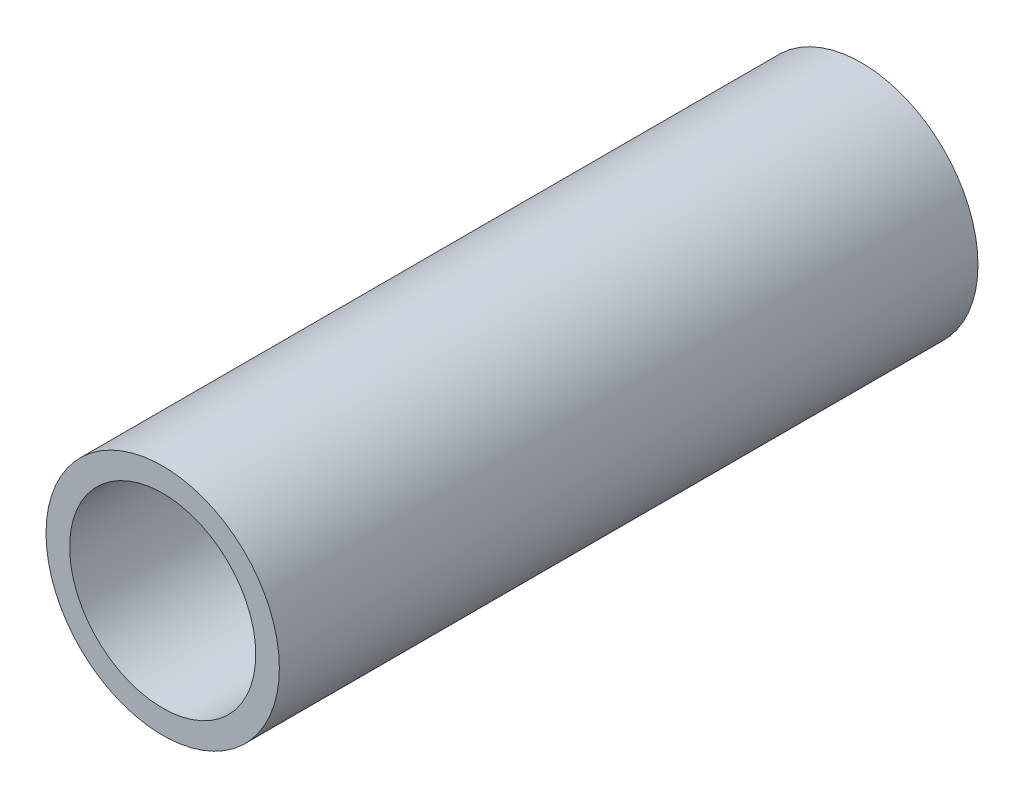
from build123d import *

# Parameters (mm, degrees)
SKETCH1_R           = 16.7005
SKETCH1_R_2         = 13.3223
EXTRUDE_THIN1_DEPTH = 50


with BuildPart() as part:
    # Sketch1 → Extrude-Thin1 (new, symmetric)
    with BuildSketch(Plane.XY):
        Circle(SKETCH1_R)
        Circle(SKETCH1_R_2, mode=Mode.SUBTRACT)
    extrude(amount=EXTRUDE_THIN1_DEPTH, both=True)


solid = part.part
